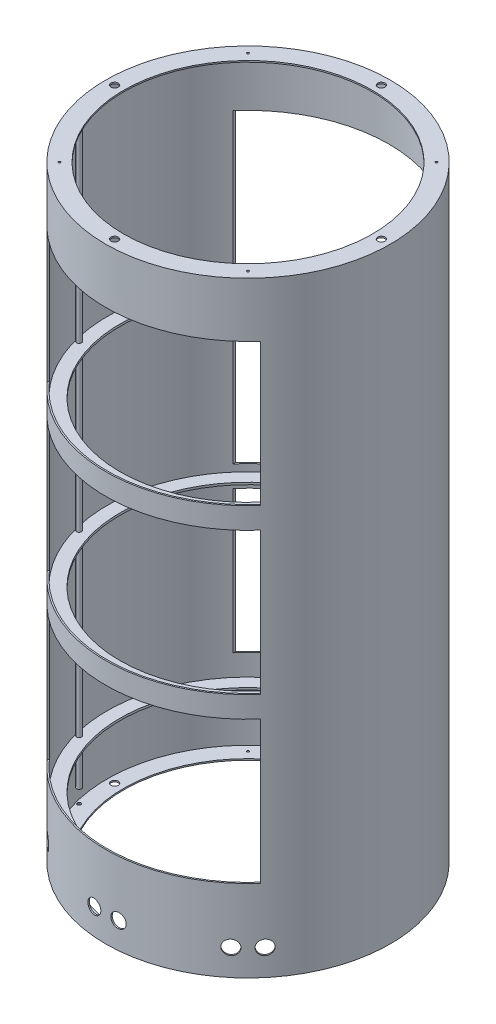
from build123d import *
from build123d.topology import SkipClean

# Parameters (mm, degrees)
SKETCH1_R                = 200
BOSS_EXTRUDE1_DEPTH      = 1000
SHELL1_T                 = -2
SKETCH3_W                = 300
SKETCH3_H                = 200
CUT_EXTRUDE2_DEPTH       = 500
CUT_EXTRUDE8_REACH       = 1041.23
SKETCH15_R               = 175
CUT_EXTRUDE11_DEPTH      = 250
CUT_EXTRUDE11_DEPTH_BACK = 350
SKETCH18_W               = 420
SKETCH18_H               = 160
SKETCH19_R               = 200
SKETCH19_R_2             = 175
BOSS_EXTRUDE3_DEPTH      = 2
SKETCH16_R               = 5.1
CUT_EXTRUDE9_DEPTH       = 910
SKETCH17_R               = 1.5
CUT_EXTRUDE10_DEPTH      = 898.721560396
BOSS_EXTRUDE4_START      = -17
SKETCH21_R               = 198
SKETCH21_R_2             = 180
BOSS_EXTRUDE4_DEPTH      = 3
LPATTERN1_COUNT          = 2
LPATTERN1_PITCH          = 230
LPATTERN2_COUNT          = 2
LPATTERN2_PITCH          = 480
BOSS_EXTRUDE5_START      = 20
SKETCH23_R               = 3.5
SKETCH23_R_2             = 2.5
BOSS_EXTRUDE5_DEPTH      = 800
SKETCH24_R               = 2.5
CUT_EXTRUDE12_DEPTH      = 632.842543677
CUT_EXTRUDE13_REACH      = 1113.338
CUT_EXTRUDE13_END_RADIUS = 198
SKETCH26_R               = 10
CUT_EXTRUDE14_REACH      = 1098.177
CUT_EXTRUDE14_END_RADIUS = 198
SKETCH28_R               = 10
SKETCH29_R               = 10
CUT_EXTRUDE15_DEPTH      = 10


with BuildPart() as part:
    # Sketch1 → Boss-Extrude1 (new body)
    with BuildSketch(Plane(origin=(0, 0, 0), x_dir=(1, 0, 0), z_dir=(0, 1, 0))):
        with Locations(Location((0, 0, 0), (0, 0, 270))):
            Circle(SKETCH1_R)
    extrude(amount=BOSS_EXTRUDE1_DEPTH)

    # Shell1
    shell1_openings = [part.faces().sort_by_distance(p)[0] for p in [
        (0, 0, 0),
    ]]
    offset(amount=SHELL1_T, openings=shell1_openings, kind=Kind.INTERSECTION)

    # Sketch3 → Cut-Extrude2 (cut, symmetric)
    with BuildSketch(Plane.XY):
        with Locations((0, 363)):
            Rectangle(SKETCH3_W, SKETCH3_H)
        with Locations((0, 593)):
            Rectangle(SKETCH3_W, SKETCH3_H)
        with Locations((0, 823)):
            Rectangle(SKETCH3_W, SKETCH3_H)
    extrude(amount=CUT_EXTRUDE2_DEPTH, both=True, mode=Mode.SUBTRACT)

    # Sketch15 → Cut-Extrude8 (cut, up to next)
    with BuildSketch(Plane(origin=(0, 1000, 0), x_dir=(1, 0, 0), z_dir=(0, 1, 0)), mode=Mode.PRIVATE) as cut_extrude8_sk1:
        with Locations(Location((0, 0, 0), (0, 0, 270))):
            Circle(SKETCH15_R)
    cut_extrude8_tool1 = extrude(cut_extrude8_sk1.sketch, amount=-CUT_EXTRUDE8_REACH, mode=Mode.PRIVATE) & part.part
    add(cut_extrude8_tool1.solids().sort_by_distance((0, 1000, 0))[0], mode=Mode.SUBTRACT)

    # Sketch18 → Cut-Extrude11 (cut, two sides: drawn at the far end of the back side and taken through both)
    with BuildSketch(Plane.XY.offset(-CUT_EXTRUDE11_DEPTH_BACK)):
        with Locations((0, 70)):
            Rectangle(SKETCH18_W, SKETCH18_H)
    extrude(amount=CUT_EXTRUDE11_DEPTH + CUT_EXTRUDE11_DEPTH_BACK, mode=Mode.SUBTRACT)

    # Sketch19 → Boss-Extrude3 (add)
    with BuildSketch(Plane.XZ.offset(-150)):
        with Locations(Location((0, 0, 0), (0, 0, 270))):
            Circle(SKETCH19_R)
        with Locations(Location((0, 0, 0), (0, 0, 90))):
            Circle(SKETCH19_R_2, mode=Mode.SUBTRACT)
    extrude(amount=BOSS_EXTRUDE3_DEPTH)

    # Sketch16 → Cut-Extrude9 (cut)
    with BuildSketch(Plane(origin=(0, 1000, 0), x_dir=(1, 0, 0), z_dir=(0, 1, 0))):
        with Locations(Location((0, 187.5, 0), (0, 0, 270))):
            Circle(SKETCH16_R)
        with Locations(Location((187.5, 0, 0), (0, 0, 270))):
            Circle(SKETCH16_R)
        with Locations(Location((0, -187.5, 0), (0, 0, 270))):
            Circle(SKETCH16_R)
        with Locations(Location((-187.5, 0, 0), (0, 0, 270))):
            Circle(SKETCH16_R)
    extrude(amount=-CUT_EXTRUDE9_DEPTH, mode=Mode.SUBTRACT)

    # Sketch17 → Cut-Extrude10 (cut, through all)
    with BuildSketch(Plane(origin=(0, 1000, 0), x_dir=(1, 0, 0), z_dir=(0, 1, 0))):
        with Locations(Location((-132.582521472, 132.582521472, 0), (0, 0, 270))):
            Circle(SKETCH17_R)
        with Locations(Location((132.582521472, 132.582521472, 0), (0, 0, 270))):
            Circle(SKETCH17_R)
        with Locations(Location((132.582521472, -132.582521472, 0), (0, 0, 270))):
            Circle(SKETCH17_R)
        with Locations(Location((-132.582521472, -132.582521472, 0), (0, 0, 270))):
            Circle(SKETCH17_R)
    extrude(amount=-CUT_EXTRUDE10_DEPTH, mode=Mode.SUBTRACT)

    # Sketch21 → Boss-Extrude4 (add)
    with BuildSketch(Plane(origin=(0, 693, 0), x_dir=(-1, 0, 0), z_dir=(0, -1, 0)).offset(BOSS_EXTRUDE4_START)):
        with Locations(Location((0, 0, 0), (0, 0, 90))):
            Circle(SKETCH21_R)
        with Locations(Location((0, 0, 0), (0, 0, 90))):
            Circle(SKETCH21_R_2, mode=Mode.SUBTRACT)
    boss_extrude4 = extrude(amount=-BOSS_EXTRUDE4_DEPTH)

    # LPattern1: Boss-Extrude4 ×2
    with Locations(*[(0, -i * LPATTERN1_PITCH, 0) for i in range(1, LPATTERN1_COUNT)]):
        add(boss_extrude4)

    # LPattern2: Boss-Extrude4 ×2
    with Locations(*[(0, -i * LPATTERN2_PITCH, 0) for i in range(1, LPATTERN2_COUNT)]):
        add(boss_extrude4)

    # Sketch23 → Boss-Extrude5 (add)
    with BuildSketch(Plane(origin=(0, 150, 0), x_dir=(1, 0, 0), z_dir=(0, 1, 0)).offset(BOSS_EXTRUDE5_START)):
        with Locations(Location((-187.446, -49.99997084, 0), (0, 0, 90))):
            Circle(SKETCH23_R)
        with Locations(Location((-187.446, -49.99997084, 0), (0, 0, 90))):
            Circle(SKETCH23_R_2, mode=Mode.SUBTRACT)
    extrude(amount=BOSS_EXTRUDE5_DEPTH)

    # Sketch24 → Cut-Extrude12 (cut, through all)
    with SkipClean():  # the faces are left unmerged after this step: merging them gives an invalid solid
        with BuildSketch(Plane(origin=(0, 713, 0), x_dir=(1, 0, 0), z_dir=(0, 1, 0))):
            with Locations(Location((-187.446, -49.99997084, 0), (0, 0, 270))):
                Circle(SKETCH24_R)
        extrude(amount=-CUT_EXTRUDE12_DEPTH, mode=Mode.SUBTRACT)

    # Cut-Extrude13: up to this cylinder (the profile starts outside it)
    with SkipClean():  # the faces are left unmerged after this step: merging them gives an invalid solid
        cut_extrude13_end = Plane(origin=(0, 184.8, 0), z_dir=(0, -1, 0)) * Cylinder(CUT_EXTRUDE13_END_RADIUS, 2623.676, mode=Mode.PRIVATE)
        # Sketch26 → Cut-Extrude13 (cut, up to the surface)
        with BuildSketch(Plane(origin=(-142.8355698, 0, 142.8355698), x_dir=(0.7071067811865465, 0, 0.7071067811865487), z_dir=(-0.7071067811865487, 0, 0.7071067811865465)), mode=Mode.PRIVATE) as cut_extrude13_sk1:
            with Locations((-17, 184.8)):
                Circle(SKETCH26_R)
        cut_extrude13_tool1 = extrude(cut_extrude13_sk1.sketch, amount=-CUT_EXTRUDE13_REACH, mode=Mode.PRIVATE) - cut_extrude13_end
        add(cut_extrude13_tool1.solids().sort_by_distance((-154.856385, 184.8, 130.814755))[0], mode=Mode.SUBTRACT)
        # Sketch26 → Cut-Extrude13 (cut, up to the surface)
        with BuildSketch(Plane(origin=(-142.8355698, 0, 142.8355698), x_dir=(0.7071067811865465, 0, 0.7071067811865487), z_dir=(-0.7071067811865487, 0, 0.7071067811865465)), mode=Mode.PRIVATE) as cut_extrude13_sk2:
            with Locations((17, 184.8)):
                Circle(SKETCH26_R)
        cut_extrude13_tool2 = extrude(cut_extrude13_sk2.sketch, amount=-CUT_EXTRUDE13_REACH, mode=Mode.PRIVATE) - cut_extrude13_end
        add(cut_extrude13_tool2.solids().sort_by_distance((-130.814755, 184.8, 154.856385))[0], mode=Mode.SUBTRACT)

    # Cut-Extrude14: up to this cylinder (the profile starts outside it)
    with SkipClean():  # the faces are left unmerged after this step: merging them gives an invalid solid
        cut_extrude14_end = Plane(origin=(0, 184.8, 0), z_dir=(0, -1, 0)) * Cylinder(CUT_EXTRUDE14_END_RADIUS, 2593.354, mode=Mode.PRIVATE)
        # Sketch28 → Cut-Extrude14 (cut, up to the surface)
        with BuildSketch(Plane.XY.offset(202), mode=Mode.PRIVATE) as cut_extrude14_sk1:
            with Locations((-17, 184.8)):
                Circle(SKETCH28_R)
        cut_extrude14_tool1 = extrude(cut_extrude14_sk1.sketch, amount=-CUT_EXTRUDE14_REACH, mode=Mode.PRIVATE) - cut_extrude14_end
        add(cut_extrude14_tool1.solids().sort_by_distance((-17, 184.8, 202))[0], mode=Mode.SUBTRACT)
        # Sketch28 → Cut-Extrude14 (cut, up to the surface)
        with BuildSketch(Plane.XY.offset(202), mode=Mode.PRIVATE) as cut_extrude14_sk2:
            with Locations((17, 184.8)):
                Circle(SKETCH28_R)
        cut_extrude14_tool2 = extrude(cut_extrude14_sk2.sketch, amount=-CUT_EXTRUDE14_REACH, mode=Mode.PRIVATE) - cut_extrude14_end
        add(cut_extrude14_tool2.solids().sort_by_distance((17, 184.8, 202))[0], mode=Mode.SUBTRACT)

    # Sketch29 → Cut-Extrude15 (cut)
    with SkipClean():  # the faces are left unmerged after this step: merging them gives an invalid solid
        with BuildSketch(Plane(origin=(142.8355698, 0, 142.8355698), x_dir=(0.7071067811865565, 0, -0.7071067811865387), z_dir=(0.7071067811865387, 0, 0.7071067811865565))):
            with Locations((-17, 184.8)):
                Circle(SKETCH29_R)
            with Locations((17, 184.8)):
                Circle(SKETCH29_R)
        extrude(amount=-CUT_EXTRUDE15_DEPTH, mode=Mode.SUBTRACT)


solid = part.part
